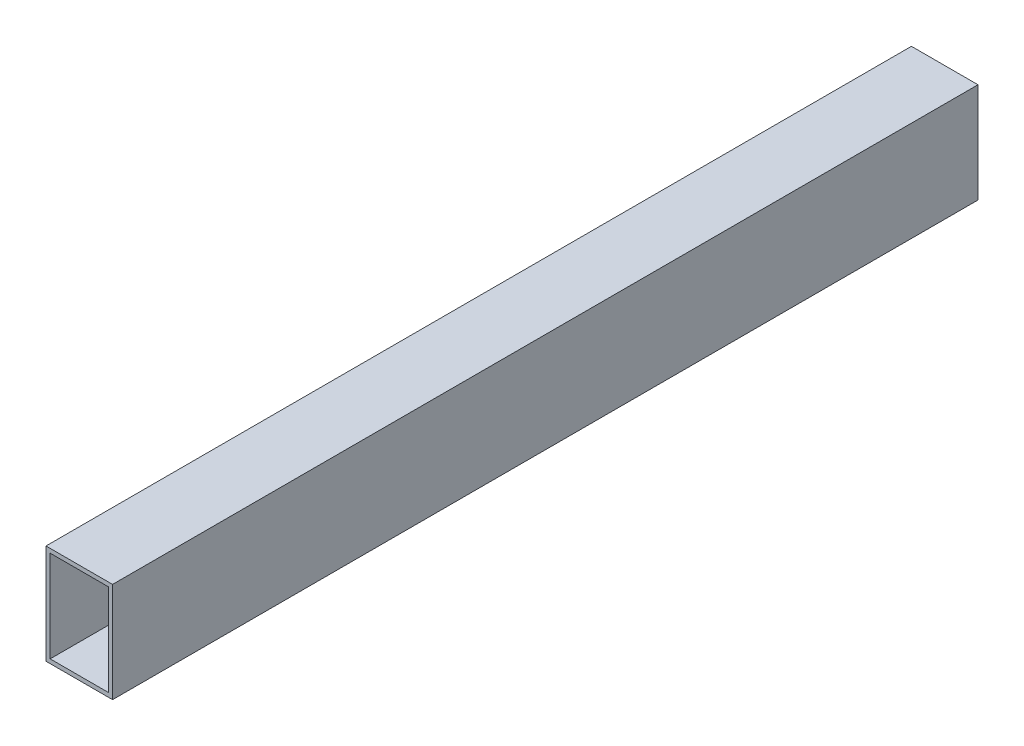
from build123d import *

# Parameters (mm, degrees)
SKETCH1_W           = 50.8
SKETCH1_H           = 76.2
BOSS_EXTRUDE1_DEPTH = 660.4
SHELL1_T            = -3.175


with BuildPart() as part:
    # Sketch1 → Boss-Extrude1 (new body)
    with BuildSketch(Plane.XY):
        Rectangle(SKETCH1_W, SKETCH1_H)
    extrude(amount=BOSS_EXTRUDE1_DEPTH)

    # Shell1
    shell1_openings = [part.faces().sort_by_distance(p)[0] for p in [
        (0, 0, 660.4),
        (0, 0, 0),
    ]]
    offset(amount=SHELL1_T, openings=shell1_openings, kind=Kind.INTERSECTION)


solid = part.part
